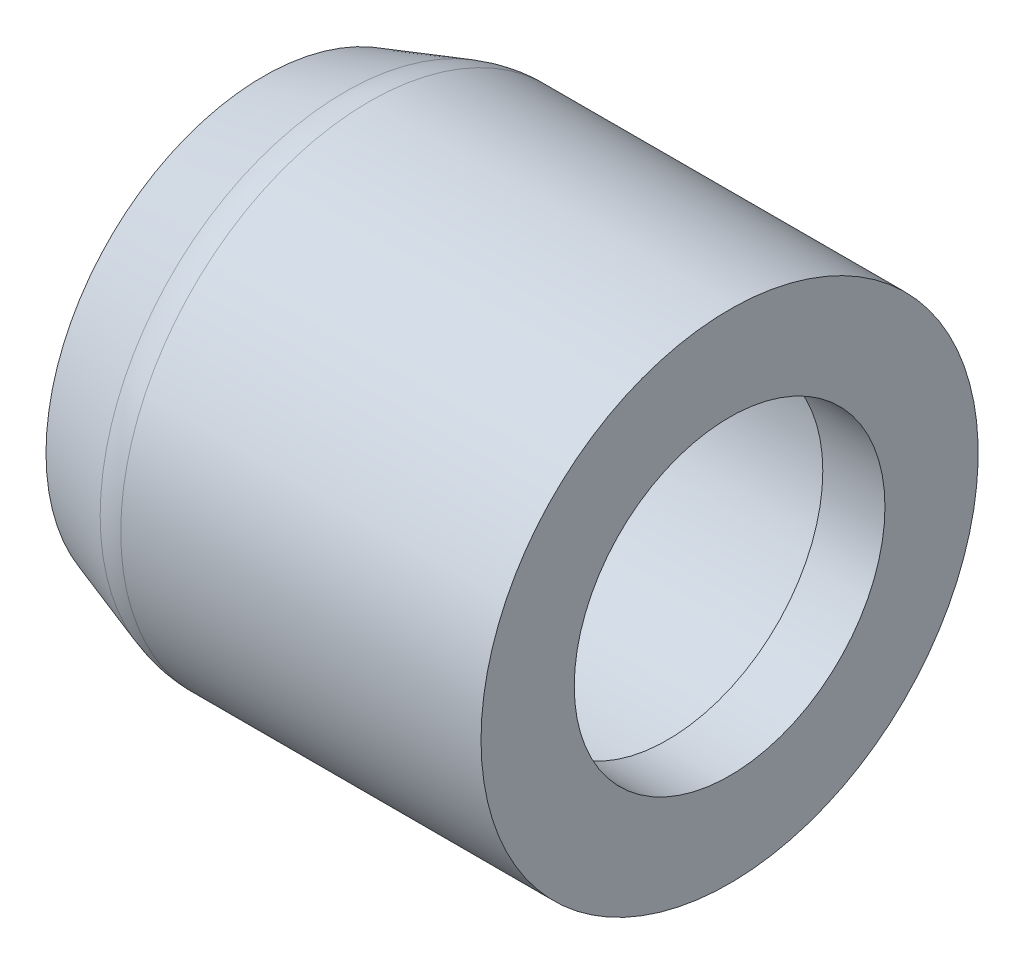
from build123d import *

# Parameters (mm, degrees)
REDONDEO1_R = 5


with BuildPart() as part:
    # Croquis1 → Revolución1 (revolve)
    with BuildSketch(Plane.XY, mode=Mode.PRIVATE) as revoluci_n1_sk:
        Polygon((0, 12.5), (26, 12.5), (26, 10), (30, 10), (30, 16), (6, 16), (0, 14), align=None)
    revolve(revoluci_n1_sk.sketch.rotate(Axis((0, 0, 0), (1, 0, 0)), 90), axis=Axis((0, 0, 0), (1, 0, 0)))

    # Redondeo1
    redondeo1_edges = [part.edges().sort_by_distance(p)[0] for p in [
        (6, 0, -16),
    ]]
    fillet(redondeo1_edges, radius=REDONDEO1_R)


solid = part.part
